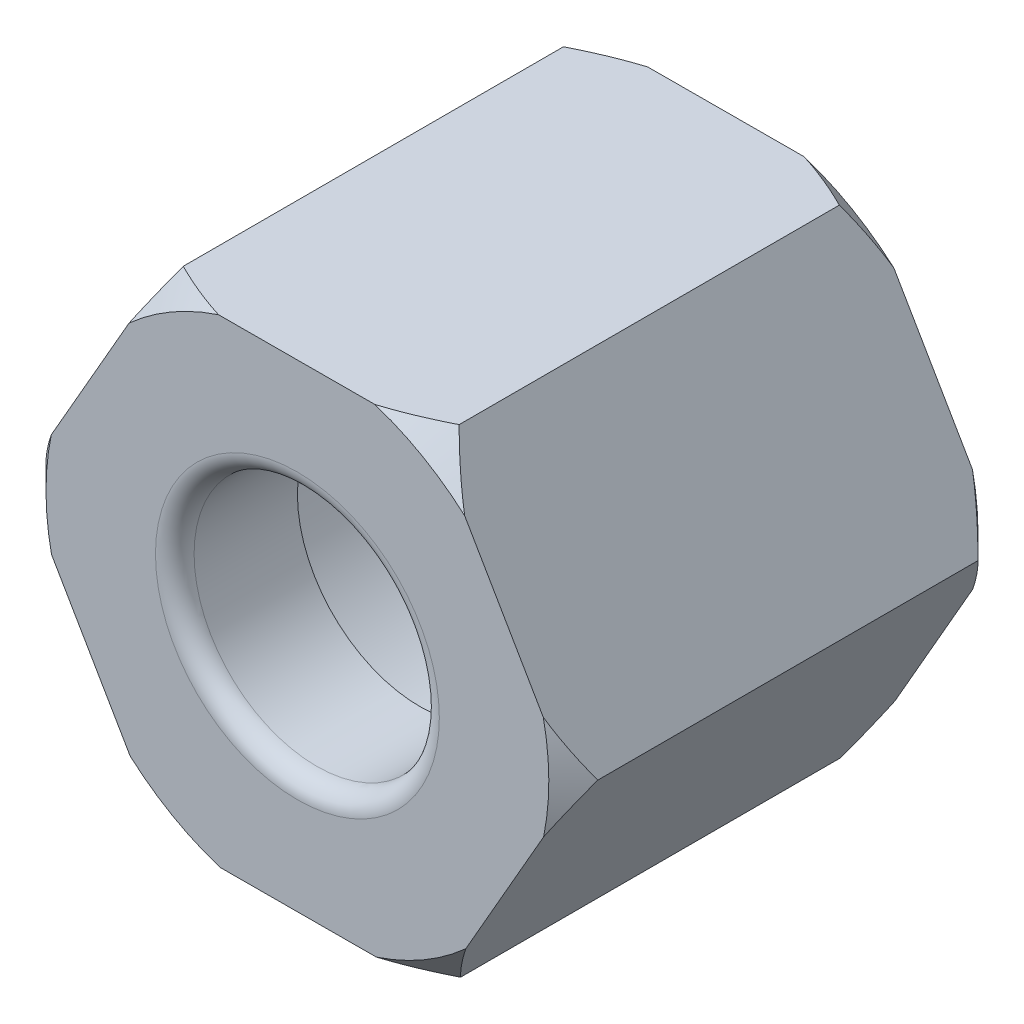
from build123d import *

# Parameters (mm, degrees)
ESBO_O1_R                = 3.175
RESSALTO_EXTRUS_O1_DEPTH = 11.1125
ESBO_O2_R                = 4.9609375
CORTE_EXTRUS_O1_DEPTH    = 7.9375
FILETE1_R                = 0.5


with BuildPart() as part:
    # Esboço1 → Ressalto-extrusão1 (new body)
    with BuildSketch(Plane.XY):
        Polygon((3.553451716, 6.197269154), (-3.590266663, 6.176014034), (-7.143718379, -0.021255119), (-3.553451716, -6.197269154), (3.590266663, -6.176014034), (7.143718379, 0.021255119), align=None)
        Circle(ESBO_O1_R, mode=Mode.SUBTRACT)
    extrude(amount=RESSALTO_EXTRUS_O1_DEPTH)

    # Esboço2 → Corte-extrusão1 (cut)
    with BuildSketch(Plane(origin=(0, 0, 0), x_dir=(-1, 0, 0), z_dir=(0, 0, -1))):
        Circle(ESBO_O2_R)
    extrude(amount=-CORTE_EXTRUS_O1_DEPTH, mode=Mode.SUBTRACT)

    # Filete1
    filete1_edges = [part.edges().sort_by_distance(p)[0] for p in [
        (-3.175, 0, 11.1125),
    ]]
    fillet(filete1_edges, radius=FILETE1_R)

    # Esboço4 → Corte-Revolução4 (revolve, cut)
    with BuildSketch(Plane(origin=(0, 0, 0), x_dir=(1, 0, 0), z_dir=(0, 1, 0)), mode=Mode.PRIVATE) as corte_revolu_o4_sk:
        Polygon((6.409669222, -16.266104521), (6.409669222, -11.2125), (9.269615278, -8.352553944), (9.269615278, -16.266104521), align=None)
        Polygon((6.409669222, 5.153604521), (9.269615278, 5.153604521), (9.269615278, -2.759946056), (6.409669222, 0.1), align=None)
    revolve(corte_revolu_o4_sk.sketch.rotate(Axis((0, 0, 23.395635865), (0, 0, -1)), 180), axis=Axis((0, 0, 23.395635865), (0, 0, -1)), mode=Mode.SUBTRACT)


solid = part.part
